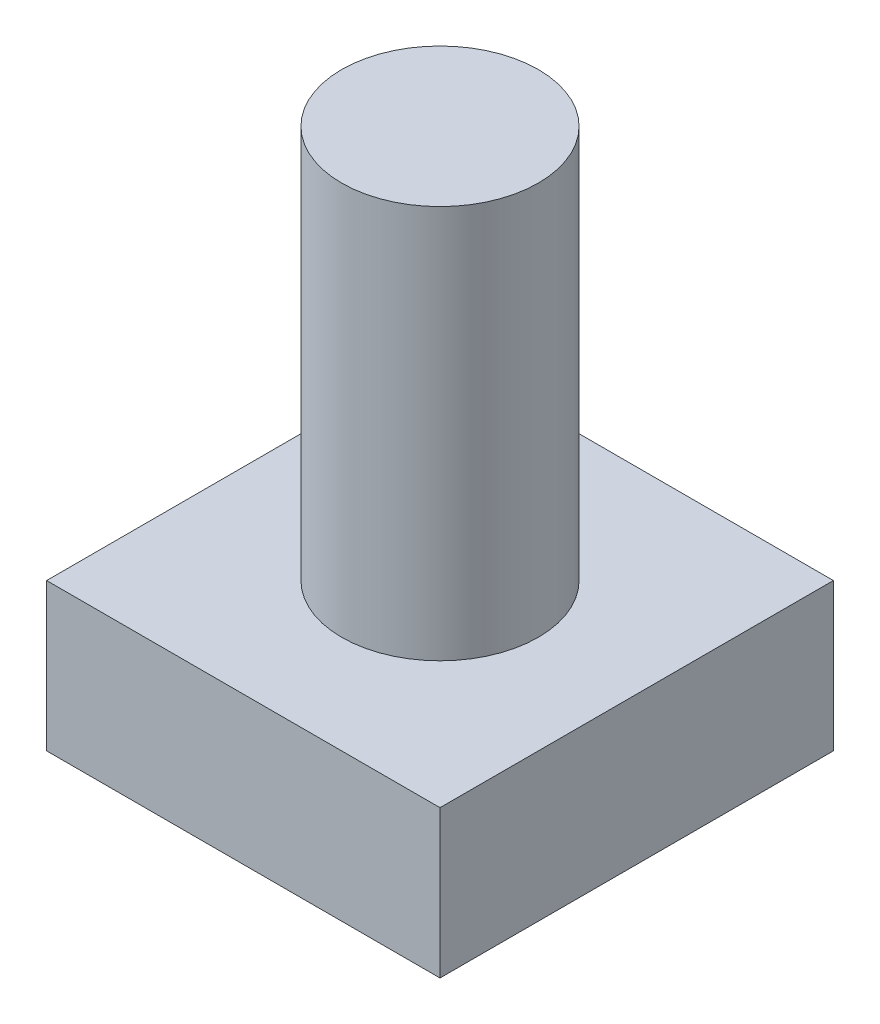
from build123d import *

# Parameters (mm, degrees)
SKETCH1_W           = 4
SKETCH1_H           = 1.5
BOSS_EXTRUDE1_DEPTH = 4
SKETCH2_R           = 1
BOSS_EXTRUDE2_DEPTH = 4


with BuildPart() as part:
    # Sketch1 → Boss-Extrude1 (new body)
    with BuildSketch(Plane.XY):
        Rectangle(SKETCH1_W, SKETCH1_H)
    extrude(amount=BOSS_EXTRUDE1_DEPTH)

    # Sketch2 → Boss-Extrude2 (add)
    with BuildSketch(Plane(origin=(0, 0.75, 0), x_dir=(1, 0, 0), z_dir=(0, 1, 0))):
        with Locations(Location((0, -2, 0), (0, 0, 270))):
            Circle(SKETCH2_R)
    extrude(amount=BOSS_EXTRUDE2_DEPTH)


solid = part.part
